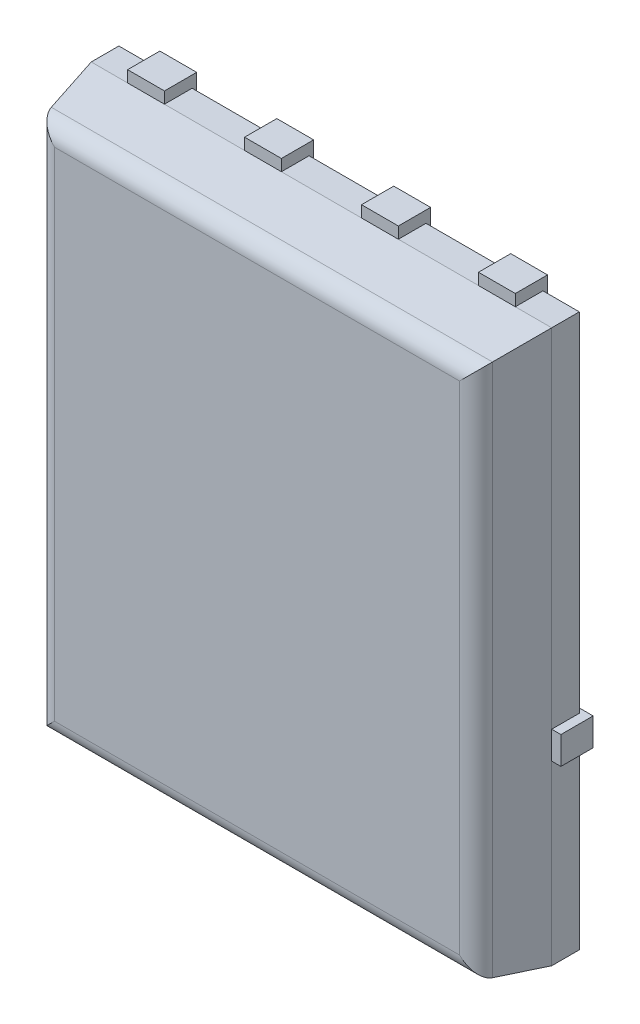
from build123d import *

# Parameters (mm, degrees)
BOSS_EXTRUDE1_START           = 0.3
SKETCH1_W                     = 5
SKETCH1_H                     = 6
BOSS_EXTRUDE1_DEPTH           = 0.3
BOSS_EXTRUDE1_OTHER_WAY_DEPTH = 0.7
BOSS_EXTRUDE1_OTHER_WAY_TAPER = 11
FILLET1_R                     = 0.2
BOSS_EXTRUDE2_DEPTH           = 0.05
BOSS_EXTRUDE2_DEPTH_BACK      = 0.3
SKETCH3_W                     = 0.4
SKETCH3_H                     = 0.6


with BuildPart() as part:
    # Sketch1 → Boss-Extrude1 (new body)
    with BuildSketch(Plane.XY.offset(BOSS_EXTRUDE1_START)):
        Rectangle(SKETCH1_W, SKETCH1_H)
    extrude(amount=-BOSS_EXTRUDE1_DEPTH)

    # Sketch1 → Boss-Extrude1 other way (add)
    with BuildSketch(Plane.XY.offset(BOSS_EXTRUDE1_START)):
        Rectangle(SKETCH1_W, SKETCH1_H)
    extrude(amount=BOSS_EXTRUDE1_OTHER_WAY_DEPTH, taper=BOSS_EXTRUDE1_OTHER_WAY_TAPER)

    # Fillet1
    fillet1_edges = [part.edges().sort_by_distance(p)[0] for p in [
        (-2.363933784, 0, 1),
        (0, -2.863933784, 1),
        (2.363933784, 0, 1),
        (0, 2.863933784, 1),
    ]]
    fillet(fillet1_edges, radius=FILLET1_R)

    # Sketch3 → Boss-Extrude2 (add, two sides: drawn at the far end of the back side and taken through both)
    with BuildSketch(Plane(origin=(0, 0, 0), x_dir=(-1, 0, 0), z_dir=(0, 0, -1)).offset(-BOSS_EXTRUDE2_DEPTH_BACK)):
        with Locations((1.905, -2.825)):
            Rectangle(SKETCH3_W, SKETCH3_H)
        with Locations((0.635, -2.825)):
            Rectangle(SKETCH3_W, SKETCH3_H)
        with Locations((-0.635, -2.825)):
            Rectangle(SKETCH3_W, SKETCH3_H)
        with Locations((-1.905, -2.825)):
            Rectangle(SKETCH3_W, SKETCH3_H)
        Polygon((2.105, 2.525), (2.105, 3.125), (1.705, 3.125), (1.705, 2.525), (0.835, 2.525), (0.835, 3.125), (0.435, 3.125), (0.435, 2.525), (-0.435, 2.525), (-0.435, 3.125), (-0.835, 3.125), (-0.835, 2.525), (-1.705, 2.525), (-1.705, 3.125), (-2.105, 3.125), (-2.105, 2.525), (-2.2, 2.525), (-2.2, -0.775), (-2.6, -0.775), (-2.6, -1.075), (2.6, -1.075), (2.6, -0.775), (2.2, -0.775), (2.2, 2.525), align=None)
    extrude(amount=BOSS_EXTRUDE2_DEPTH + BOSS_EXTRUDE2_DEPTH_BACK)


solid = part.part
